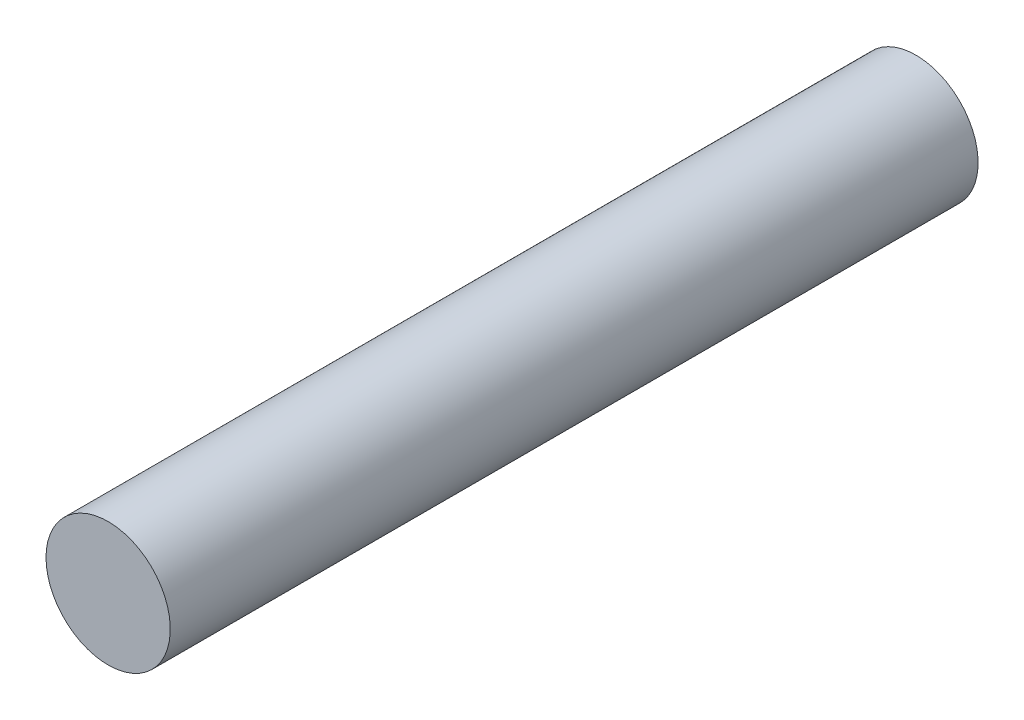
from build123d import *

# Parameters (mm, degrees)
SKETCH1_R           = 1
BOSS_EXTRUDE1_DEPTH = 13


with BuildPart() as part:
    # Sketch1 → Boss-Extrude1 (new body)
    with BuildSketch(Plane.XY):
        with Locations(Location((-50.625690998, 32.547660704, 0), (0, 0, 180))):
            Circle(SKETCH1_R)
    extrude(amount=BOSS_EXTRUDE1_DEPTH)


solid = part.part
